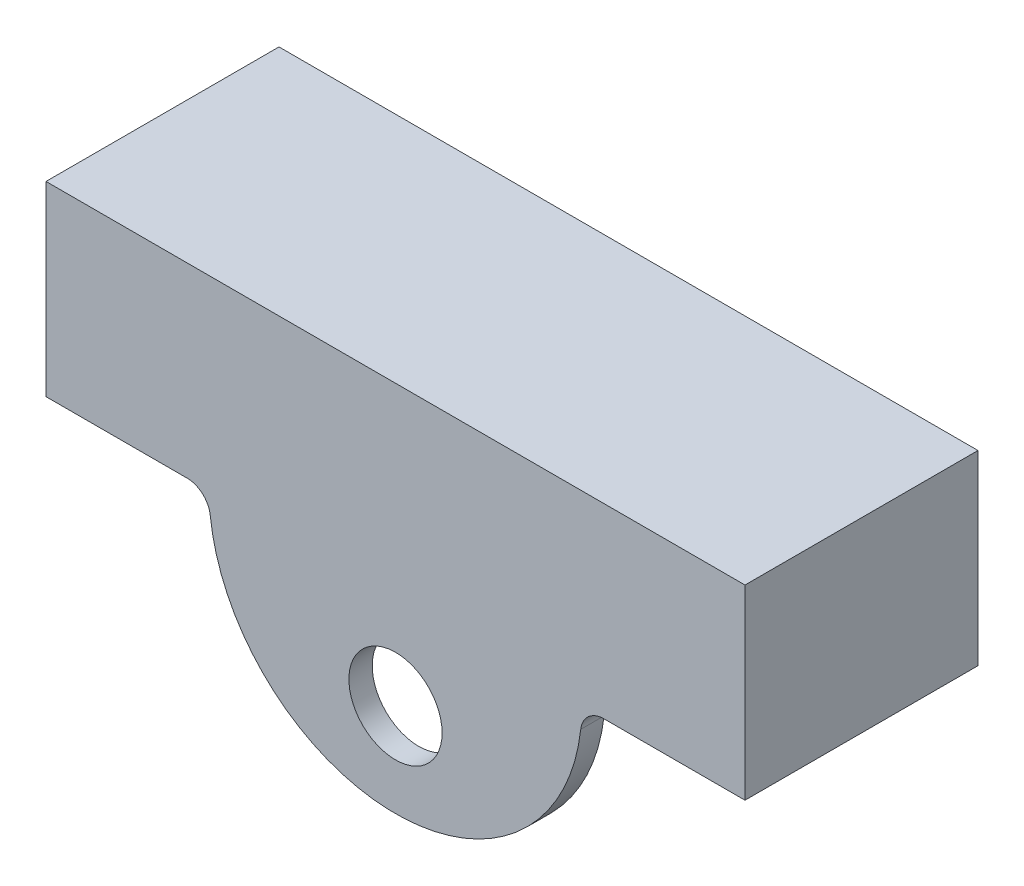
from build123d import *

# Parameters (mm, degrees)
BOSS_EXTRUDE1_DEPTH     = 50
SHELL2_T                = -5
FILLET1_R               = 5
CUT_EXTRUDE2_DEPTH      = 121.519707932
CUT_EXTRUDE2_DEPTH_BACK = 121.519707932
SKETCH1_4_R             = 10


with BuildPart() as part:
    # Sketch1 → Boss-Extrude1 (new body)
    with BuildSketch(Plane.XY):
        with BuildLine():
            Line((75, 0), (-75, 0))
            Line((-75, 0), (-75, -40))
            Line((-75, -40), (-40, -40))
            ThreePointArc((-40, -40), (0, -80), (40, -40))
            Line((40, -40), (75, -40))
            Line((75, -40), (75, 0))
        make_face()
    extrude(amount=BOSS_EXTRUDE1_DEPTH)

    # Shell2
    shell2_openings = [part.faces().sort_by_distance(p)[0] for p in [
        (57.5, -40, 25),
        (0, -80, 25),
        (-57.5, -40, 25),
    ]]
    offset(amount=SHELL2_T, openings=shell2_openings, kind=Kind.INTERSECTION)

    # Fillet1
    fillet1_edges = [part.edges().sort_by_distance(p)[0] for p in [
        (40, -40, 2.5),
        (40, -40, 47.5),
        (-40, -40, 2.5),
        (-40, -40, 47.5),
    ]]
    fillet(fillet1_edges, radius=FILLET1_R)

    # Sketch1<4> → Cut-Extrude2 (cut, two sides: drawn at the far end of the back side and taken through both)
    with BuildSketch(Plane.XY.offset(-CUT_EXTRUDE2_DEPTH_BACK)):
        with Locations((0, -60)):
            Circle(SKETCH1_4_R)
    extrude(amount=CUT_EXTRUDE2_DEPTH + CUT_EXTRUDE2_DEPTH_BACK, mode=Mode.SUBTRACT)


solid = part.part
